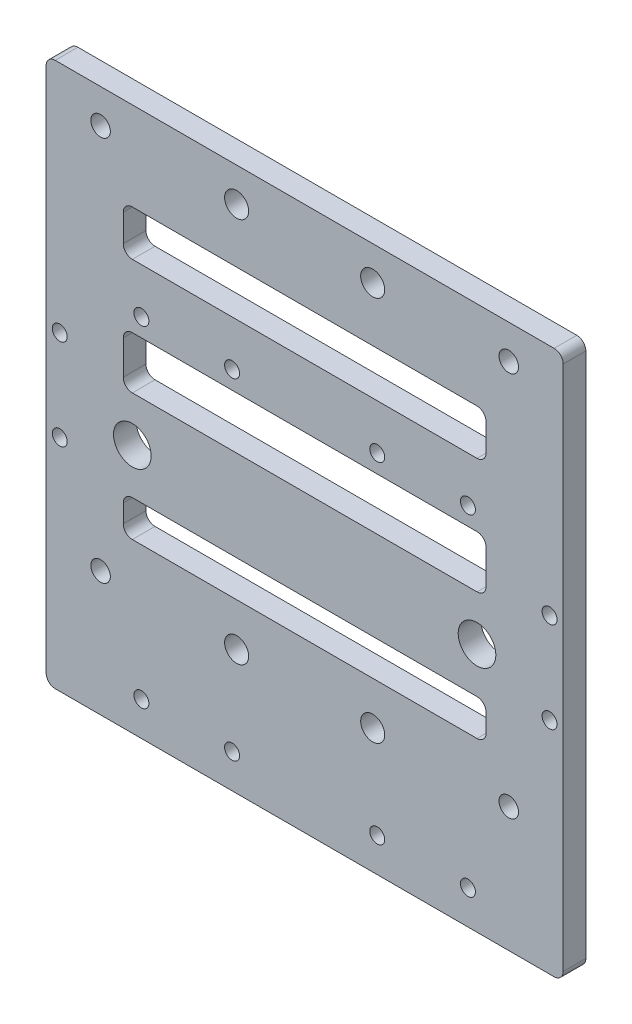
from build123d import *

# Parameters (mm, degrees)
SKETCH_1_W          = 114
SKETCH_1_H          = 120
SKETCH_1_R          = 2.65
SKETCH_1_R_2        = 2.15
EXTRUDE_1_DEPTH     = 5
SKETCH_2_R          = 1.65
CUT_EXTRUDE_1_DEPTH = 83.909589313
SKETCH_3_R          = 4.15
CUT_EXTRUDE_2_DEPTH = 83.909589313
SKETCH_6_R          = 1.65
CUT_EXTRUDE_4_DEPTH = 83.909589313
SKETCH_7_W          = 80
SKETCH_7_H          = 11.5
SKETCH_7_H_2        = 10
SKETCH_7_H_3        = 8
CUT_EXTRUDE_5_DEPTH = 83.909589313
FILLET_1_R          = 2


with BuildPart() as part:
    # 草图1 → 凸台-拉伸1 (new body)
    with BuildSketch(Plane.XY):
        Rectangle(SKETCH_1_W, SKETCH_1_H)
        with Locations((-15, -32.5)):
            Circle(SKETCH_1_R, mode=Mode.SUBTRACT)
        with Locations((15, -32.5)):
            Circle(SKETCH_1_R, mode=Mode.SUBTRACT)
        with Locations((-45, -32.5)):
            Circle(SKETCH_1_R_2, mode=Mode.SUBTRACT)
        with Locations(Location((45, -32.5, 0), (0, 0, 180))):
            Circle(SKETCH_1_R_2, mode=Mode.SUBTRACT)
        with Locations((-45, 52.5)):
            Circle(SKETCH_1_R_2, mode=Mode.SUBTRACT)
        with Locations((-15, 52.5)):
            Circle(SKETCH_1_R, mode=Mode.SUBTRACT)
        with Locations((15, 52.5)):
            Circle(SKETCH_1_R, mode=Mode.SUBTRACT)
        with Locations(Location((45, 52.5, 0), (0, 0, 180))):
            Circle(SKETCH_1_R_2, mode=Mode.SUBTRACT)
    extrude(amount=EXTRUDE_1_DEPTH)

    # 草图2 → 切除-拉伸1 (cut, through all)
    with BuildSketch(Plane.XY.offset(5)):
        with Locations((-16, -52.5)):
            Circle(SKETCH_2_R)
        with Locations((-36, -52.5)):
            Circle(SKETCH_2_R)
        with Locations(Location((16, -52.5, 0), (0, 0, 180))):
            Circle(SKETCH_2_R)
        with Locations(Location((36, -52.5, 0), (0, 0, 180))):
            Circle(SKETCH_2_R)
        with Locations((-16, 20.5)):
            Circle(SKETCH_2_R)
        with Locations((-36, 20.5)):
            Circle(SKETCH_2_R)
        with Locations(Location((16, 20.5, 0), (0, 0, 180))):
            Circle(SKETCH_2_R)
        with Locations(Location((36, 20.5, 0), (0, 0, 180))):
            Circle(SKETCH_2_R)
    extrude(amount=-CUT_EXTRUDE_1_DEPTH, mode=Mode.SUBTRACT)

    # 草图3 → 切除-拉伸2 (cut, through all)
    with BuildSketch(Plane.XY.offset(5)):
        with Locations((-38, -5)):
            Circle(SKETCH_3_R)
        with Locations(Location((38, -5, 0), (0, 0, 180))):
            Circle(SKETCH_3_R)
    extrude(amount=-CUT_EXTRUDE_2_DEPTH, mode=Mode.SUBTRACT)

    # 草图6 → 切除-拉伸4 (cut, through all)
    with BuildSketch(Plane.XY.offset(5)):
        with Locations((54, -11.5)):
            Circle(SKETCH_6_R)
        with Locations((54, 8.5)):
            Circle(SKETCH_6_R)
        with Locations(Location((-54, -11.5, 0), (0, 0, 180))):
            Circle(SKETCH_6_R)
        with Locations(Location((-54, 8.5, 0), (0, 0, 180))):
            Circle(SKETCH_6_R)
    extrude(amount=-CUT_EXTRUDE_4_DEPTH, mode=Mode.SUBTRACT)

    # 草图7 → 切除-拉伸5 (cut, through all)
    with BuildSketch(Plane.XY.offset(5)):
        with Locations((0, 10.75)):
            Rectangle(SKETCH_7_W, SKETCH_7_H)
        with Locations((0, 35.5)):
            Rectangle(SKETCH_7_W, SKETCH_7_H_2)
        with Locations((0, -19)):
            Rectangle(SKETCH_7_W, SKETCH_7_H_3)
    extrude(amount=-CUT_EXTRUDE_5_DEPTH, mode=Mode.SUBTRACT)

    # 圆角1
    fillet_1_edges = [part.edges().sort_by_distance(p)[0] for p in [
        (-40, -23, 2.5),
        (-40, -15, 2.5),
        (40, -15, 2.5),
        (40, -23, 2.5),
        (-40, 30.5, 2.5),
        (-40, 40.5, 2.5),
        (40, 40.5, 2.5),
        (40, 30.5, 2.5),
        (-40, 5, 2.5),
        (-40, 16.5, 2.5),
        (40, 16.5, 2.5),
        (40, 5, 2.5),
        (57, -60, 2.5),
        (-57, -60, 2.5),
        (-57, 60, 2.5),
        (57, 60, 2.5),
    ]]
    fillet(fillet_1_edges, radius=FILLET_1_R)


solid = part.part
